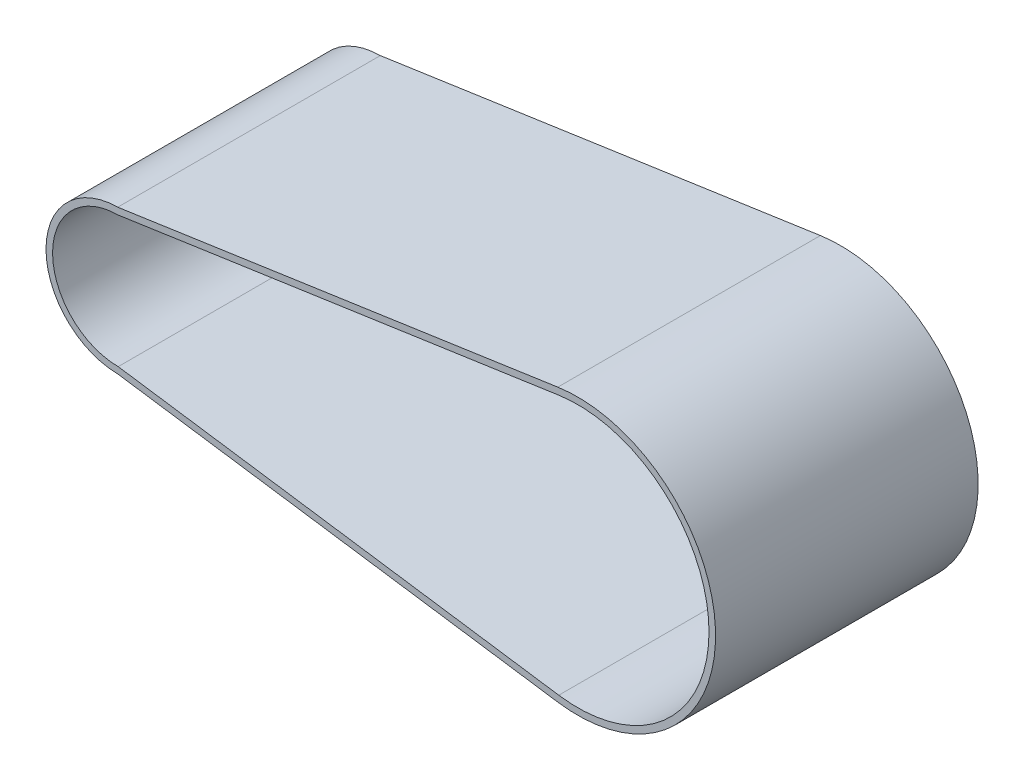
from build123d import *

# Parameters (mm, degrees)
EXTRUDE_2_DEPTH = 200


with BuildPart() as part:
    # 草图1 → 凸台-拉伸2 (new body)
    with BuildSketch(Plane.XY):
        with BuildLine():
            Line((334.842892965, 103.900250752), (-0.371378358, 54.99874615))
            ThreePointArc((-0.371378358, 54.99874615), (-55, 0), (-0.371378358, -54.99874615))
            Line((-0.371378358, -54.99874615), (334.842892965, -103.900250752))
            ThreePointArc((334.842892965, -103.900250752), (455, 0), (334.842892965, 103.900250752))
        make_face()
        with BuildLine():
            Line((335.564659966, 98.952619764), (0, 50))
            ThreePointArc((0, 50), (-50, 0), (0, -50))
            Line((0, -50), (335.564659966, -98.952619764))
            ThreePointArc((335.564659966, -98.952619764), (450, 0), (335.564659966, 98.952619764))
        make_face(mode=Mode.SUBTRACT)
    extrude(amount=EXTRUDE_2_DEPTH)


solid = part.part
